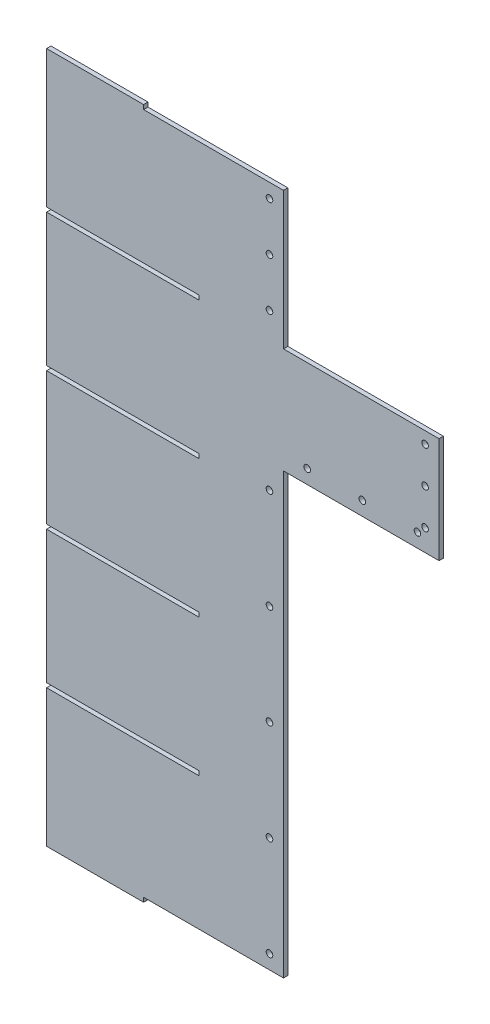
from build123d import *

# Parameters (mm, degrees)
BOSS_EXTRUDE2_DEPTH  = 3.175
BOSS_EXTRUDE3_DEPTH  = 3.175
SKETCH11_W           = 113.03
SKETCH11_H           = 76.76642
BOSS_EXTRUDE8_DEPTH  = 3.175
SKETCH12_W           = 70.49262
SKETCH12_H           = 3.175
BOSS_EXTRUDE9_DEPTH  = 3.175
M4_CLEARANCE_HOLE1_D = 4.8


with BuildPart() as part:
    # Sketch1 → Boss-Extrude2 (new body)
    with BuildSketch(Plane.XY):
        Polygon((129.013076168, 254.245404572), (-18.685383832, 254.245404572), (-18.685383832, 157.666984572), (92.088461168, 157.666984572), (92.088461168, 154.491984572), (-18.685383832, 154.491984572), (-18.685383832, 57.913564572), (92.088461168, 57.913564572), (92.088461168, 54.738564572), (-18.685383832, 54.738564572), (-18.685383832, -41.839855428), (92.088461168, -41.839855428), (92.088461168, -45.014855428), (-18.685383832, -45.014855428), (-18.685383832, -141.593275428), (92.088461168, -141.593275428), (92.088461168, -144.768275428), (-18.685383832, -144.768275428), (-18.685383832, -241.346695428), (129.013076168, -241.346695428), align=None)
    extrude(amount=BOSS_EXTRUDE2_DEPTH)

    # Sketch4 → Boss-Extrude3 (add, through all)
    with BuildSketch(Plane.XY.offset(3.175)):
        Polygon((129.013076168, 254.245404572), (129.013076168, -241.346695428), (153.407236168, -241.346695428), (153.407236168, -227.262720585), (153.407236168, 240.16142973), (153.407236168, 254.245404572), align=None)
    extrude(amount=-BOSS_EXTRUDE3_DEPTH)

    # Sketch11 → Boss-Extrude8 (add, through all)
    with BuildSketch(Plane.XY.offset(3.175)):
        with Locations((209.922236168, 116.108774572)):
            Rectangle(SKETCH11_W, SKETCH11_H)
    extrude(amount=-BOSS_EXTRUDE8_DEPTH)

    # Sketch12 → Boss-Extrude9 (add, through all)
    with BuildSketch(Plane(origin=(0, 0, 0), x_dir=(-1, 0, 0), z_dir=(0, 0, -1))):
        with Locations((-16.560926168, 255.832904572)):
            Rectangle(SKETCH12_W, SKETCH12_H)
        with Locations((-16.560926168, -242.934195428)):
            Rectangle(SKETCH12_W, SKETCH12_H)
    extrude(amount=-BOSS_EXTRUDE9_DEPTH)

    # M4 Clearance Hole1 (through all)
    with Locations(Plane.XY.offset(3.175)):
        with Locations((143.247236168, -231.114588646), (143.247236168, -158.222550342), (143.247236168, -85.330512037), (143.247236168, -12.438473732), (143.247236168, 60.453564572), (170.679236168, 87.885564572), (210.711682777, 87.885564572), (250.744129387, 87.885564572), (256.277236168, 93.418671354), (256.277236168, 119.646217963), (256.277236168, 145.873764572), (143.247236168, 173.572464572), (143.247236168, 208.792881182), (143.247236168, 244.013297791)):
            Hole(M4_CLEARANCE_HOLE1_D / 2)


solid = part.part
